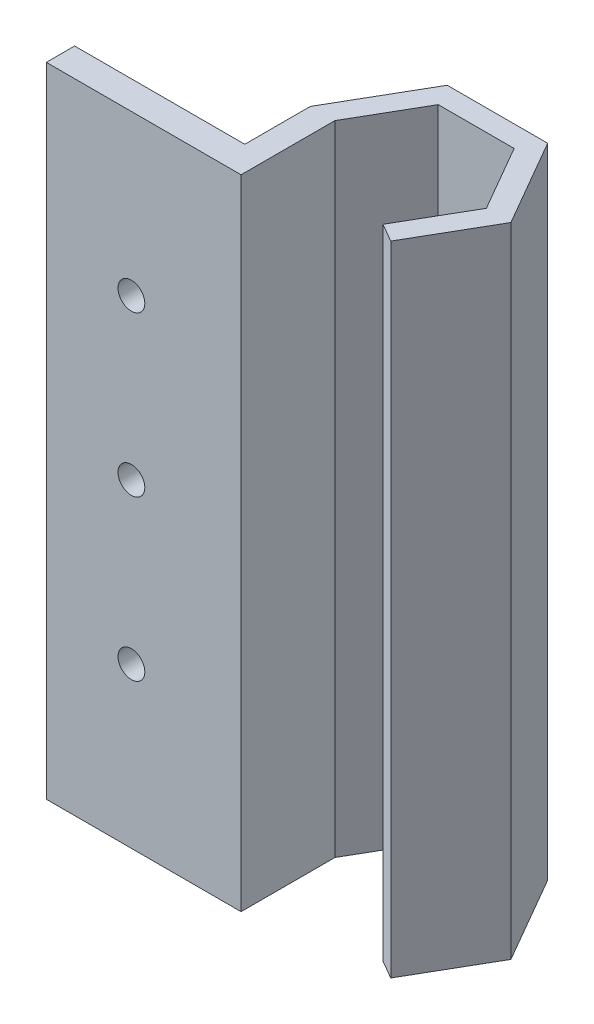
from build123d import *

# Parameters (mm, degrees)
BOSS_EXTRUDE3_DEPTH = 150
SKETCH5_R           = 3.15
CUT_EXTRUDE1_DEPTH  = 10


with BuildPart() as part:
    # Sketch4 → Boss-Extrude3 (new body)
    with BuildSketch(Plane(origin=(0, 0, 0), x_dir=(1, 0, 0), z_dir=(0, 1, 0))):
        Polygon((8.948929172, -15.4), (17.840123318, 0), (8.920061659, 15.45), (-8.920061659, 15.45), (-17.811255804, 0.05), (-17.811255804, -22), (-63.584758496, -22), (-63.584758496, -15.35), (-23.584758496, -15.35), (-23.584758496, 0.05), (-11.806813005, 20.45), (11.806813005, 20.45), (23.61362601, 0), (13.279056191, -17.9), align=None)
    extrude(amount=-BOSS_EXTRUDE3_DEPTH)

    # Sketch5 → Cut-Extrude1 (cut)
    with BuildSketch(Plane(origin=(0, 0, 15.35), x_dir=(-1, 0, 0), z_dir=(0, 0, -1))):
        with Locations((43.584758496, -37.5)):
            Circle(SKETCH5_R)
        with Locations((43.584758496, -75)):
            Circle(SKETCH5_R)
        with Locations((43.584758496, -112.5)):
            Circle(SKETCH5_R)
    extrude(amount=-CUT_EXTRUDE1_DEPTH, mode=Mode.SUBTRACT)


solid = part.part
